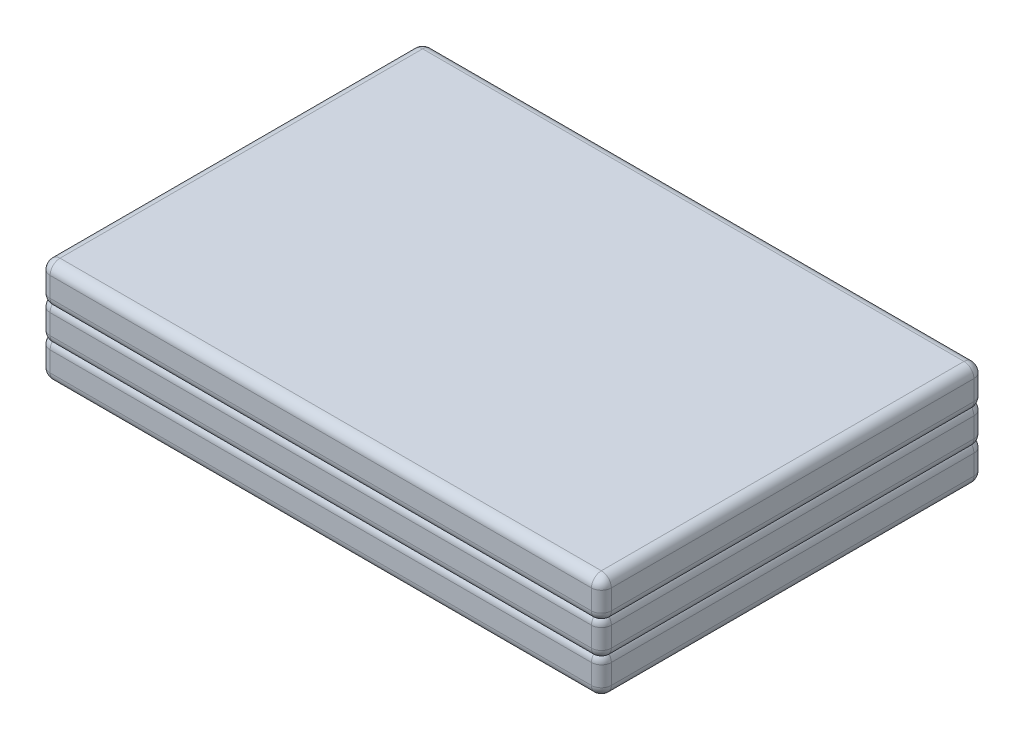
from build123d import *

# Parameters (mm, degrees)
SKETCH1_W           = 113
SKETCH1_H           = 77
BOSS_EXTRUDE1_DEPTH = 8
FILLET1_R           = 2
LPATTERN3_COUNT     = 3
LPATTERN3_PITCH     = 6.5


with BuildPart() as part:
    # Sketch1 → Boss-Extrude1 (new body)
    with BuildSketch(Plane(origin=(0, 0, 0), x_dir=(1, 0, 0), z_dir=(0, 1, 0))):
        Rectangle(SKETCH1_W, SKETCH1_H)
    extrude(amount=BOSS_EXTRUDE1_DEPTH)

    # Fillet1
    fillet1_edges = [part.edges().sort_by_distance(p)[0] for p in [
        (56.5, 8, 0),
        (0, 8, -38.5),
        (-56.5, 8, 0),
        (0, 0, -38.5),
        (56.5, 0, 0),
        (0, 0, 38.5),
        (-56.5, 0, 0),
        (0, 8, 38.5),
        (-56.5, 4, -38.5),
        (56.5, 4, -38.5),
        (56.5, 4, 38.5),
        (-56.5, 4, 38.5),
    ]]
    fillet(fillet1_edges, radius=FILLET1_R)


with BuildPart() as lpattern3_1:
    # LPattern3: pattern copy
    add(part.part.moved(Location(Vector(0, 1, 0) * (1 * LPATTERN3_PITCH))))


with BuildPart() as lpattern3_2:
    # LPattern3: pattern copy
    add(part.part.moved(Location(Vector(0, 1, 0) * (2 * LPATTERN3_PITCH))))


with BuildPart() as part_1:
    add(part.part)

    # Combine1: union LPattern3_2, LPattern3_1
    add(lpattern3_2.part)
    add(lpattern3_1.part)


solid = part_1.part
